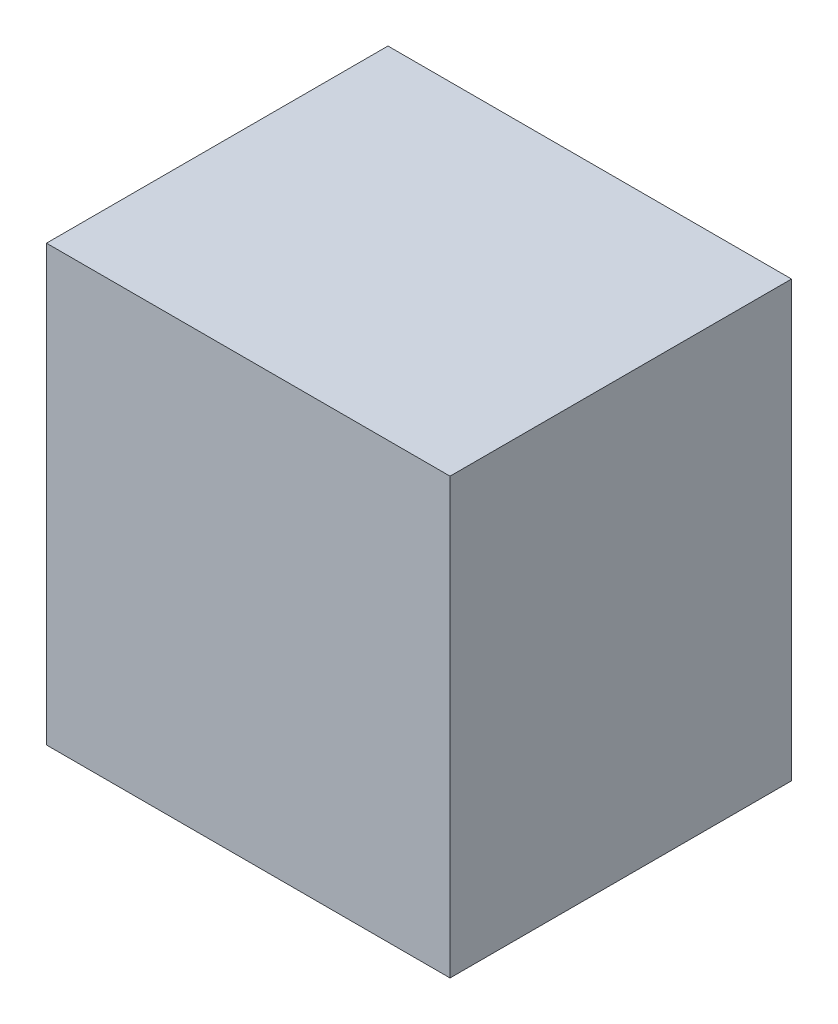
from build123d import *

# Parameters (mm, degrees)
SKETCH1_W           = 325
SKETCH1_H           = 350
BOSS_EXTRUDE1_DEPTH = 275


with BuildPart() as part:
    # Sketch1 → Boss-Extrude1 (new body)
    with BuildSketch(Plane(origin=(0, 0, 0), x_dir=(-1, 0, 0), z_dir=(0, 0, -1))):
        Rectangle(SKETCH1_W, SKETCH1_H)
    extrude(amount=-BOSS_EXTRUDE1_DEPTH)


solid = part.part
